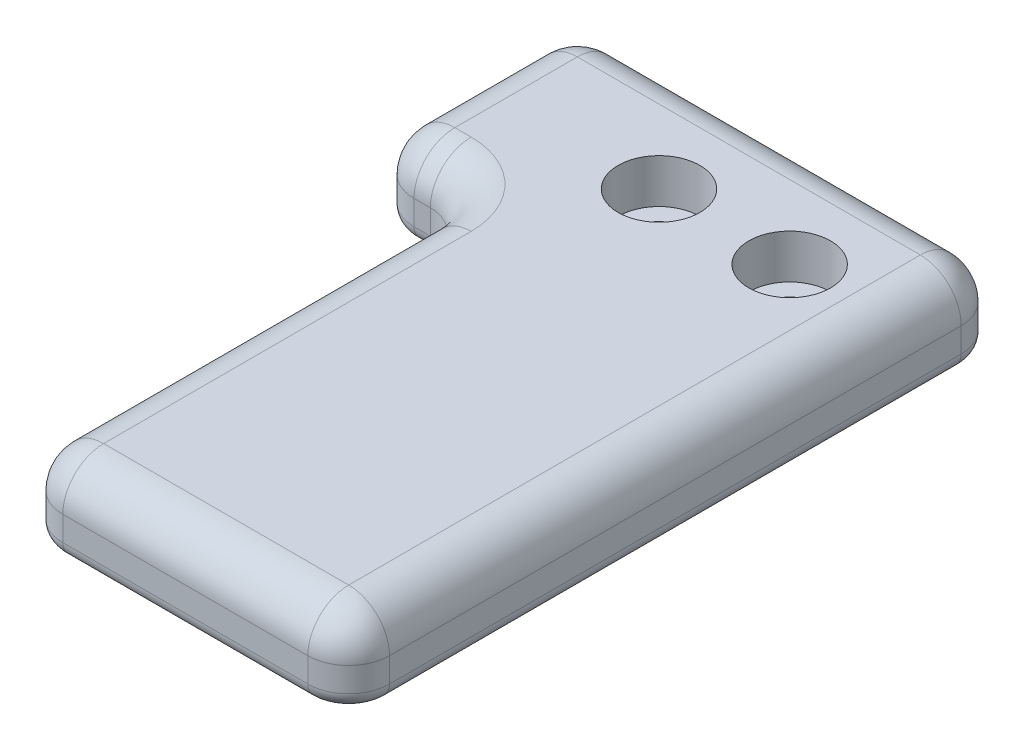
from build123d import *

# Parameters (mm, degrees)
SALIENTE_EXTRUIR1_DEPTH         = 10
REDONDEO2_R                     = 5
REDONDEO3_R                     = 5
REDONDEO5_R                     = 2
TALADRO_ROSCADO_M51_D           = 5.5
TALADRO_ROSCADO_M51_CBORE_D     = 10
TALADRO_ROSCADO_M51_CBORE_DEPTH = 5.4


with BuildPart() as part:
    # Croquis1 → Saliente-Extruir1 (new body)
    with BuildSketch(Plane(origin=(0, 0, 0), x_dir=(1, 0, 0), z_dir=(0, 1, 0))):
        Polygon((27.79756746, -8), (27.79756746, 47), (15.79756746, 47), (15.79756746, 72), (67.79756746, 72), (67.79756746, -8), align=None)
    extrude(amount=SALIENTE_EXTRUIR1_DEPTH)

    # Redondeo2
    redondeo2_edges = [part.edges().sort_by_distance(p)[0] for p in [
        (15.79756746, 5, -72),
        (67.79756746, 5, -72),
        (67.79756746, 5, 8),
        (27.79756746, 5, 8),
        (27.79756746, 5, -47),
        (15.79756746, 5, -47),
    ]]
    fillet(redondeo2_edges, radius=REDONDEO2_R)

    # Redondeo3
    redondeo3_edges = [part.edges().sort_by_distance(p)[0] for p in [
        (47.79756746, 10, 8),
        (27.79756746, 10, -19.5),
        (15.79756746, 10, -59.5),
        (21.79756746, 10, -47),
        (67.79756746, 10, -32),
        (41.79756746, 10, -72),
        (17.262033554, 10, -48.464466094),
        (66.333101366, 10, 6.535533906),
        (66.333101366, 10, -70.535533906),
        (17.262033554, 10, -70.535533906),
        (29.262033554, 10, 6.535533906),
        (26.333101366, 10, -45.535533906),
    ]]
    fillet(redondeo3_edges, radius=REDONDEO3_R)

    # Redondeo5
    redondeo5_edges = [part.edges().sort_by_distance(p)[0] for p in [
        (47.79756746, 0, 8),
        (15.79756746, 0, -59.5),
        (41.79756746, 0, -72),
        (67.79756746, 0, -32),
        (27.79756746, 0, -19.5),
        (21.79756746, 0, -47),
        (17.262033554, 0, -48.464466094),
        (66.333101366, 0, 6.535533906),
        (66.333101366, 0, -70.535533906),
        (17.262033554, 0, -70.535533906),
        (29.262033554, 0, 6.535533906),
        (26.333101366, 0, -45.535533906),
    ]]
    fillet(redondeo5_edges, radius=REDONDEO5_R)

    # Taladro roscado M51 (through all)
    with Locations(Plane(origin=(-0.50897812, 10, 14.967559644), x_dir=(-1, 0, 0), z_dir=(0, 1, 0))):
        with Locations((-56.30654558, -72.967559644), (-40.30654558, -72.967559644)):
            CounterBoreHole(TALADRO_ROSCADO_M51_D / 2, TALADRO_ROSCADO_M51_CBORE_D / 2, TALADRO_ROSCADO_M51_CBORE_DEPTH)


solid = part.part
